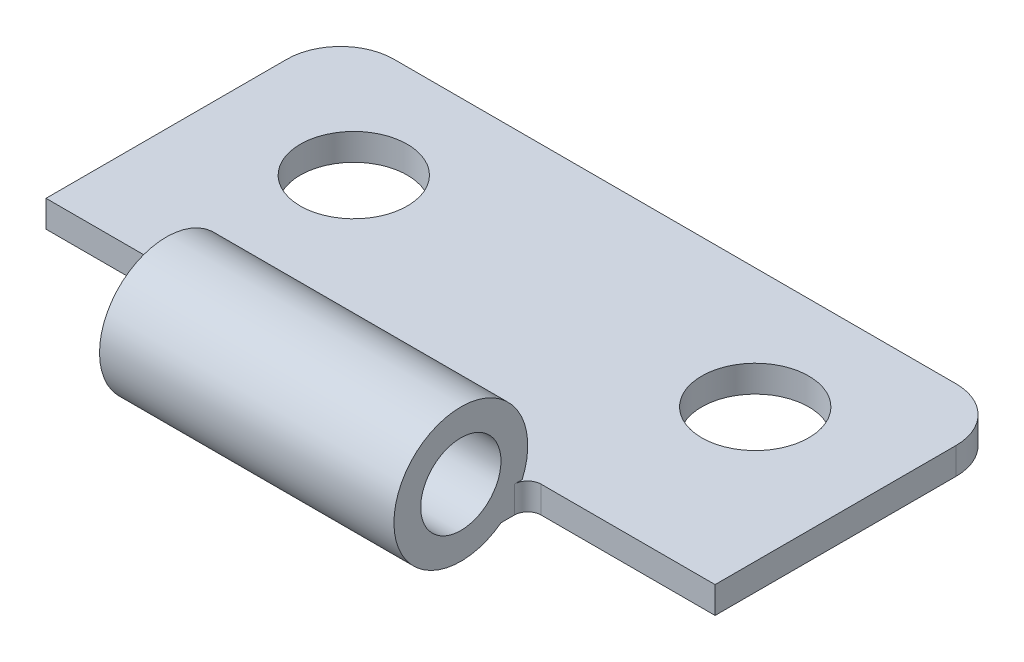
from build123d import *

# Parameters (mm, degrees)
SKETCH_1_R      = 2
EXTRUDE_1_DEPTH = 1
FILLET_1_R      = 2
FILLET_2_R      = 0.5
SKETCH_3_R      = 2.5
SKETCH_3_R_2    = 1.5
EXTRUDE_2_DEPTH = 5.5


with BuildPart() as part:
    # 草图1 → 凸台-拉伸1 (new body)
    with BuildSketch(Plane(origin=(0, 0, 0), x_dir=(1, 0, 0), z_dir=(0, 1, 0))):
        Polygon((-12.5, 1), (-5.5, 1), (-5.5, 0), (5.5, 0), (5.5, 1), (12.5, 1), (12.5, 12), (-12.5, 12), align=None)
        with Locations(Location((7.5, 7.5, 0), (0, 0, 270))):
            Circle(SKETCH_1_R, mode=Mode.SUBTRACT)
        with Locations(Location((-7.5, 7.5, 0), (0, 0, 270))):
            Circle(SKETCH_1_R, mode=Mode.SUBTRACT)
    extrude(amount=EXTRUDE_1_DEPTH)

    # 圆角1
    fillet_1_edges = [part.edges().sort_by_distance(p)[0] for p in [
        (-12.5, 0.5, -12),
        (12.5, 0.5, -12),
    ]]
    fillet(fillet_1_edges, radius=FILLET_1_R)

    # 圆角2
    fillet_2_edges = [part.edges().sort_by_distance(p)[0] for p in [
        (5.5, 0.5, -1),
        (-5.5, 0.5, -1),
    ]]
    fillet(fillet_2_edges, radius=FILLET_2_R)

    # 草图3 → 凸台-拉伸2 (add, symmetric)
    with BuildSketch(Plane(origin=(0, 0, 0), x_dir=(0, 0, -1), z_dir=(1, 0, 0))):
        with Locations((-1.5, 2)):
            Circle(SKETCH_3_R)
        with Locations((-1.5, 2)):
            Circle(SKETCH_3_R_2, mode=Mode.SUBTRACT)
    extrude(amount=EXTRUDE_2_DEPTH, both=True)


solid = part.part
